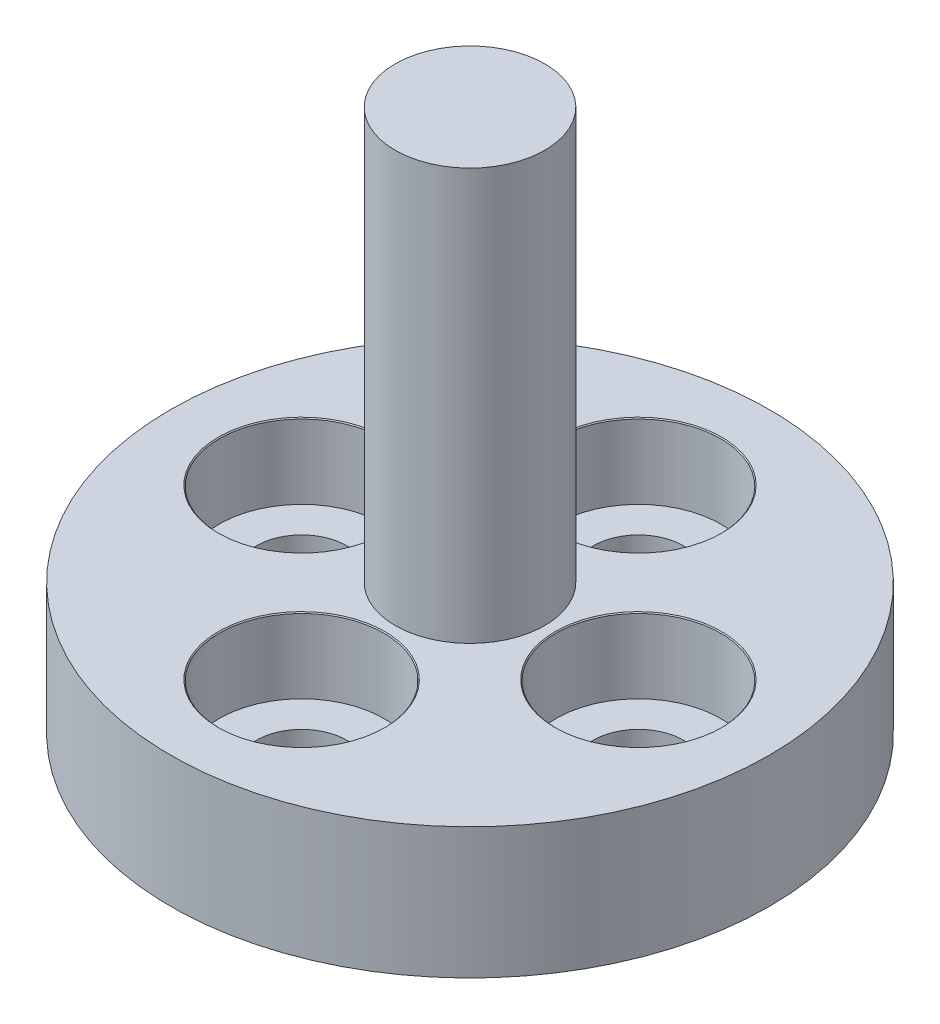
from build123d import *

# Parameters (mm, degrees)
CBORE_FOR_M2_SHCS1_AT_2_COUNT = 2
CBORE_FOR_M2_SHCS1_AT_2_PITCH = 6.363961031
CBORE_FOR_M2_SHCS1_AT_3_COUNT = 2
CBORE_FOR_M2_SHCS1_AT_3_PITCH = 9
CBORE_FOR_M2_SHCS1_AT_4_COUNT = 2
CBORE_FOR_M2_SHCS1_AT_4_PITCH = 6.363961031


with BuildPart() as part:
    # Sketch1 → Revolve1 (revolve)
    with BuildSketch(Plane.XY, mode=Mode.PRIVATE) as revolve1_sk:
        Polygon((0, 0), (8, 0), (8, 3.5), (2, 3.5), (2, 14.5), (0, 14.5), align=None)
    revolve(revolve1_sk.sketch.rotate(Axis((0, 14.5, 0), (0, -1, 0)), 180), axis=Axis((0, 14.5, 0), (0, -1, 0)))

    # Sketch5 → CBORE for M2 SHCS1 (revolve, cut)
    with BuildSketch(Plane(origin=(-4.5, 3.5, 0), x_dir=(0, 0, 1), z_dir=(1, 0, 0))):
        Polygon((0, 0), (0, 3.5), (1.2, 3.5), (1.2, 2), (2.2, 2), (2.2, 0.025), (2.225, 0), align=None)
    cbore_for_m2_shcs1 = revolve(axis=Axis((-4.5, 9.85, 0), (0, -1, 0)), mode=Mode.SUBTRACT)

    # CBORE for M2 SHCS1 at 2: CBORE for M2 SHCS1 ×2
    with Locations(*[Vector(0.7071067811865476, 0, -0.7071067811865476) * (i * CBORE_FOR_M2_SHCS1_AT_2_PITCH) for i in range(1, CBORE_FOR_M2_SHCS1_AT_2_COUNT)]):
        add(cbore_for_m2_shcs1, mode=Mode.SUBTRACT)

    # CBORE for M2 SHCS1 at 3: CBORE for M2 SHCS1 ×2
    with Locations(*[(i * CBORE_FOR_M2_SHCS1_AT_3_PITCH, 0, 0) for i in range(1, CBORE_FOR_M2_SHCS1_AT_3_COUNT)]):
        add(cbore_for_m2_shcs1, mode=Mode.SUBTRACT)

    # CBORE for M2 SHCS1 at 4: CBORE for M2 SHCS1 ×2
    with Locations(*[Vector(0.7071067811865476, 0, 0.7071067811865476) * (i * CBORE_FOR_M2_SHCS1_AT_4_PITCH) for i in range(1, CBORE_FOR_M2_SHCS1_AT_4_COUNT)]):
        add(cbore_for_m2_shcs1, mode=Mode.SUBTRACT)


solid = part.part
